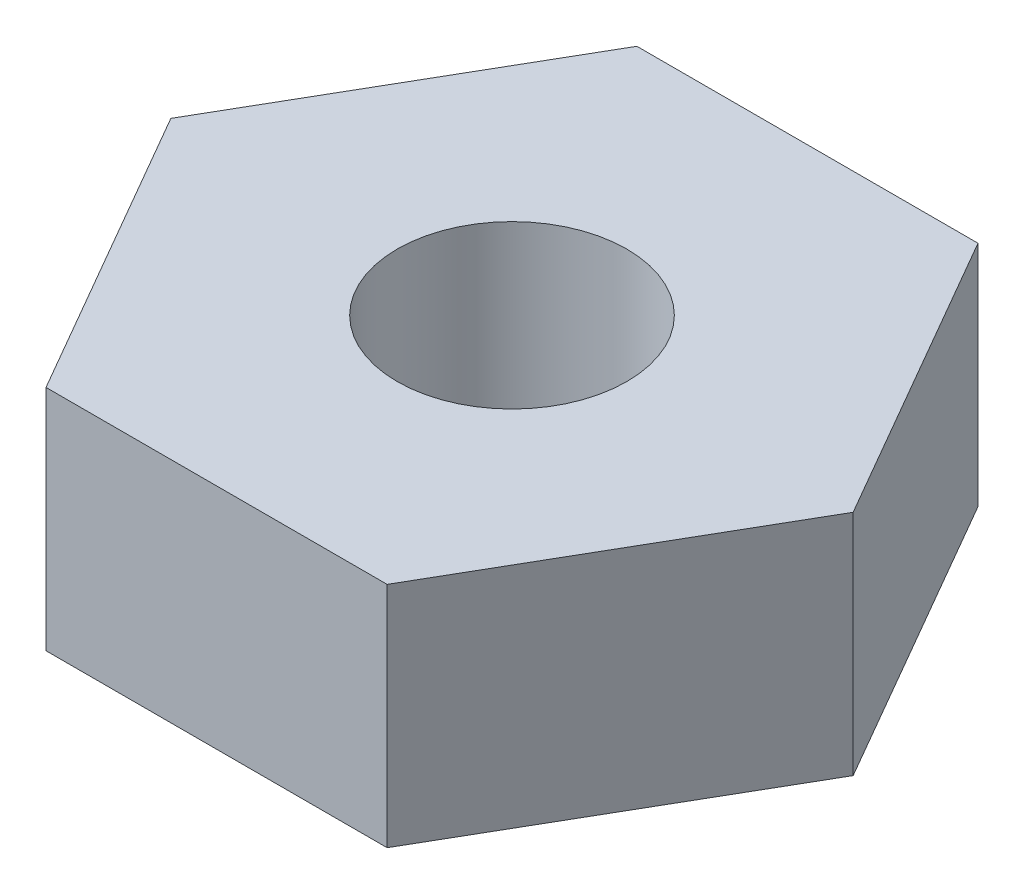
from build123d import *

# Parameters (mm, degrees)
SKETCH1_R           = 0.75
BOSS_EXTRUDE1_DEPTH = 1.49


with BuildPart() as part:
    # Sketch1 → Boss-Extrude1 (new body)
    with BuildSketch(Plane(origin=(0, 0, 0), x_dir=(1, 0, 0), z_dir=(0, 1, 0))):
        Polygon((2.228572039, 0), (1.11428602, 1.93), (-1.11428602, 1.93), (-2.228572039, 0), (-1.11428602, -1.93), (1.11428602, -1.93), align=None)
        with Locations(Location((0, 0, 0), (0, 0, 270))):
            Circle(SKETCH1_R, mode=Mode.SUBTRACT)
    extrude(amount=BOSS_EXTRUDE1_DEPTH)


solid = part.part
